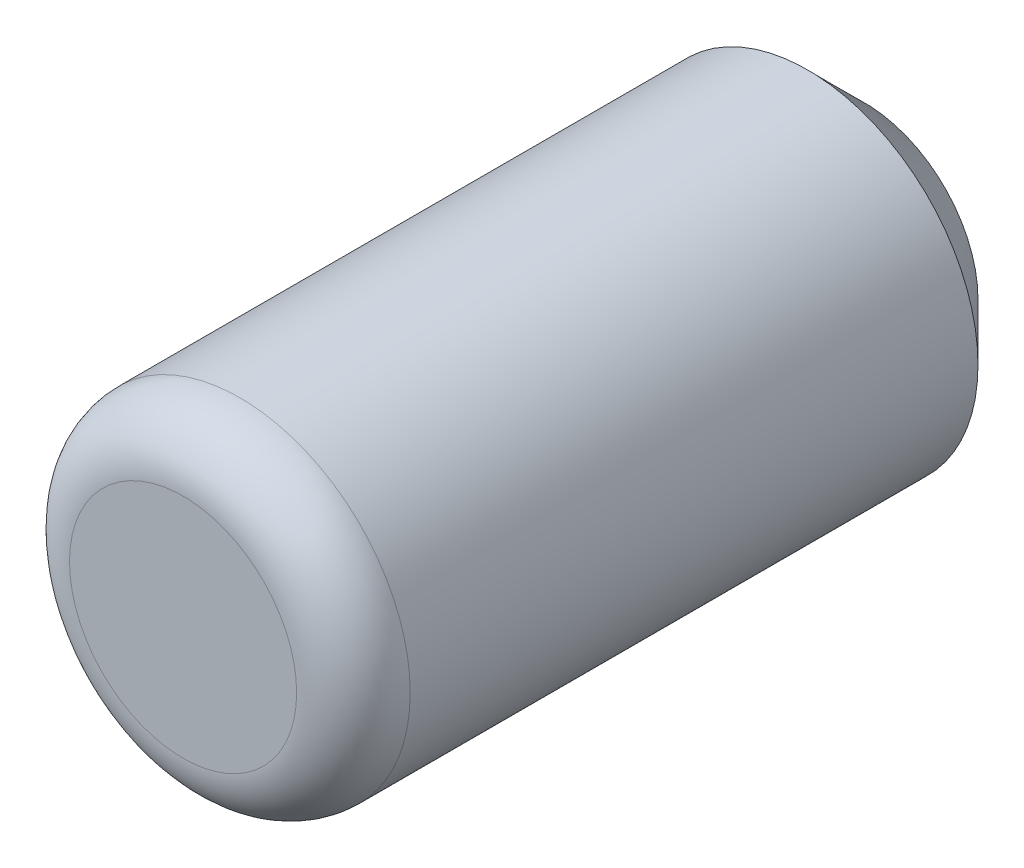
from build123d import *

# Parameters (mm, degrees)
SKETCH1_R      = 2.38125
EXTRUDE1_DEPTH = 4.7625
FILLET1_R      = 0.79375
CHAMFER1_SIZE  = 0.79375


with BuildPart() as part:
    # Sketch1 → Extrude1 (new, symmetric)
    with BuildSketch(Plane.XY):
        with Locations(Location((0, 0, 0), (0, 0, 180))):
            Circle(SKETCH1_R)
    extrude(amount=EXTRUDE1_DEPTH, both=True)

    # Fillet1
    fillet1_edges = [part.edges().sort_by_distance(p)[0] for p in [
        (2.38125, 0, 4.7625),
    ]]
    fillet(fillet1_edges, radius=FILLET1_R)

    # Chamfer1
    chamfer1_edges = [part.edges().sort_by_distance(p)[0] for p in [
        (2.38125, 0, -4.7625),
    ]]
    chamfer(chamfer1_edges, length=CHAMFER1_SIZE)


solid = part.part
